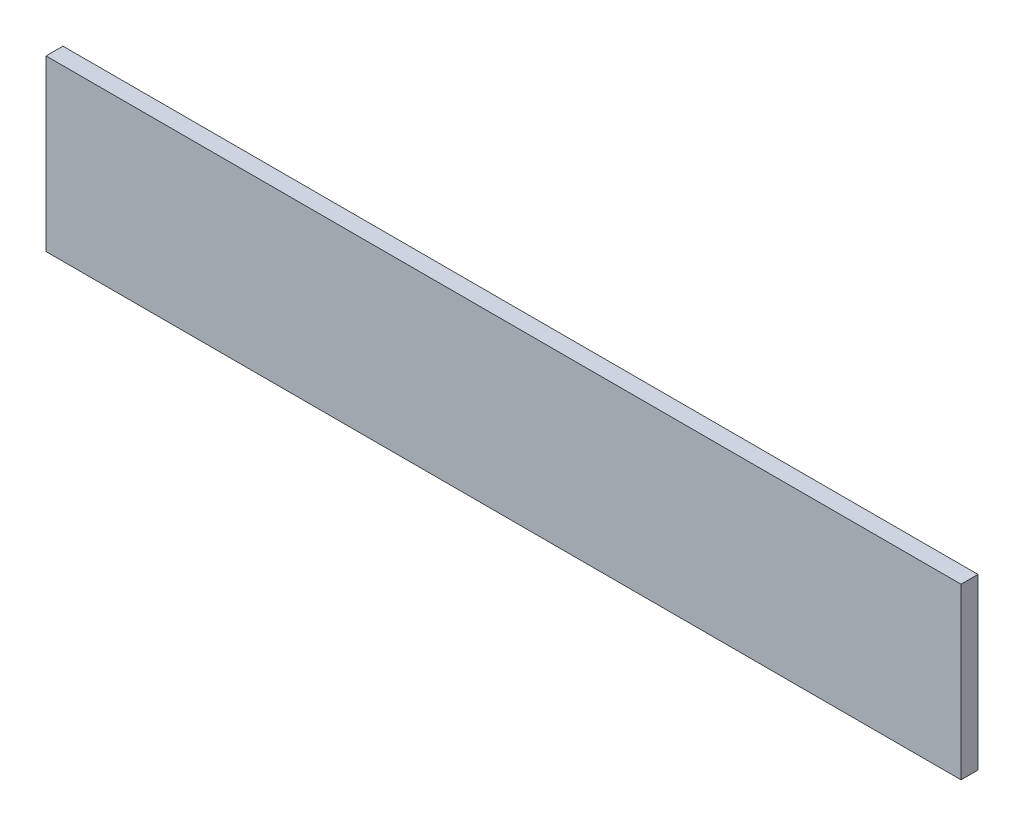
from build123d import *

# Parameters (mm, degrees)
SKETCH1_W           = 540
SKETCH1_H           = 100
BOSS_EXTRUDE1_DEPTH = 10


with BuildPart() as part:
    # Sketch1 → Boss-Extrude1 (new body)
    with BuildSketch(Plane.XY):
        with Locations((270, 50)):
            Rectangle(SKETCH1_W, SKETCH1_H)
    extrude(amount=BOSS_EXTRUDE1_DEPTH)


solid = part.part
